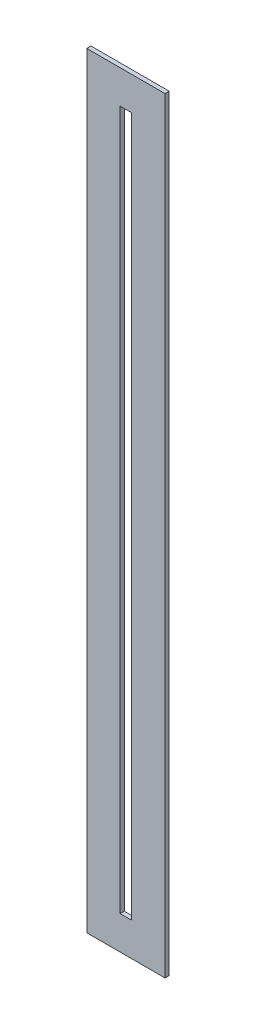
from build123d import *

# Parameters (mm, degrees)
SKETCH1_W           = 59.69
SKETCH1_H           = 584.2
SKETCH1_W_2         = 8.89
SKETCH1_H_2         = 533.4
BOSS_EXTRUDE1_DEPTH = 3.175


with BuildPart() as part:
    # Sketch1 → Boss-Extrude1 (new body)
    with BuildSketch(Plane.XY):
        with Locations((4.445, 266.7)):
            Rectangle(SKETCH1_W, SKETCH1_H)
        with Locations((4.445, 266.7)):
            Rectangle(SKETCH1_W_2, SKETCH1_H_2, mode=Mode.SUBTRACT)
    extrude(amount=BOSS_EXTRUDE1_DEPTH)


solid = part.part
